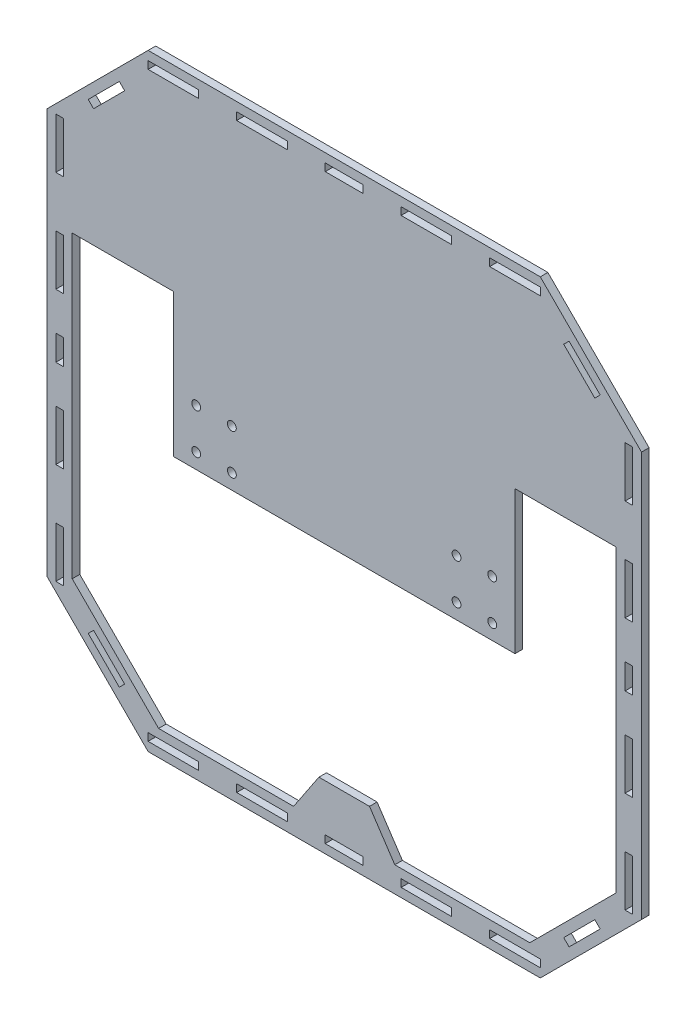
from build123d import *

# Parameters (mm, degrees)
SKICA2_R                = 1.75
SKICA2_W                = 3
SKICA2_H                = 20
SKICA2_H_2              = 10
SKICA2_W_2              = 20
SKICA2_H_3              = 3
SKICA2_W_3              = 15
P_IDAT_VYSUNUT_M1_DEPTH = 3


with BuildPart() as part:
    # Skica2 → Přidat vysunutím1 (new body)
    with BuildSketch(Plane.XY):
        Polygon((-117.5, 80), (-77.5, 120), (77.5, 120), (117.5, 80), (117.5, -80), (77.5, -120), (-77.5, -120), (-117.5, -80), align=None)
        with Locations((58.5, 8)):
            Circle(SKICA2_R, mode=Mode.SUBTRACT)
        with Locations((44.4, 8)):
            Circle(SKICA2_R, mode=Mode.SUBTRACT)
        with Locations(Location((44.4, -8, 0), (0, 0, 180))):
            Circle(SKICA2_R, mode=Mode.SUBTRACT)
        with Locations(Location((58.5, -8, 0), (0, 0, 180))):
            Circle(SKICA2_R, mode=Mode.SUBTRACT)
        with Locations((-44.4, -8)):
            Circle(SKICA2_R, mode=Mode.SUBTRACT)
        with Locations((-58.5, -8)):
            Circle(SKICA2_R, mode=Mode.SUBTRACT)
        with Locations(Location((-58.5, 8, 0), (0, 0, 180))):
            Circle(SKICA2_R, mode=Mode.SUBTRACT)
        with Locations(Location((-44.4, 8, 0), (0, 0, 180))):
            Circle(SKICA2_R, mode=Mode.SUBTRACT)
        Polygon((-107.5, -42.5), (-107.5, 42.5), (-67.5, 42.5), (-67.5, -14), (67.5, -14), (67.5, 42.5), (107.5, 42.5), (107.5, -42.5), (107.5, -75.857864376), (73.357864376, -110), (20, -110), (10, -95), (-10, -95), (-20, -110), (-73.357864376, -110), (-107.5, -75.857864376), align=None, mode=Mode.SUBTRACT)
        with Locations((-112.5, 70)):
            Rectangle(SKICA2_W, SKICA2_H, mode=Mode.SUBTRACT)
        with Locations((-112.5, 30)):
            Rectangle(SKICA2_W, SKICA2_H, mode=Mode.SUBTRACT)
        with Locations((-112.5, 0)):
            Rectangle(SKICA2_W, SKICA2_H_2, mode=Mode.SUBTRACT)
        with Locations((-112.5, -30)):
            Rectangle(SKICA2_W, SKICA2_H, mode=Mode.SUBTRACT)
        with Locations((-112.5, -70)):
            Rectangle(SKICA2_W, SKICA2_H, mode=Mode.SUBTRACT)
        with Locations((112.5, -70)):
            Rectangle(SKICA2_W, SKICA2_H, mode=Mode.SUBTRACT)
        with Locations((112.5, -30)):
            Rectangle(SKICA2_W, SKICA2_H, mode=Mode.SUBTRACT)
        with Locations((112.5, 0)):
            Rectangle(SKICA2_W, SKICA2_H_2, mode=Mode.SUBTRACT)
        with Locations((112.5, 30)):
            Rectangle(SKICA2_W, SKICA2_H, mode=Mode.SUBTRACT)
        with Locations((112.5, 70)):
            Rectangle(SKICA2_W, SKICA2_H, mode=Mode.SUBTRACT)
        with Locations((-67.5, 115)):
            Rectangle(SKICA2_W_2, SKICA2_H_3, mode=Mode.SUBTRACT)
        with Locations((-32.5, 115)):
            Rectangle(SKICA2_W_2, SKICA2_H_3, mode=Mode.SUBTRACT)
        with Locations((0, 115)):
            Rectangle(SKICA2_W_3, SKICA2_H_3, mode=Mode.SUBTRACT)
        with Locations((32.5, 115)):
            Rectangle(SKICA2_W_2, SKICA2_H_3, mode=Mode.SUBTRACT)
        with Locations((67.5, 115)):
            Rectangle(SKICA2_W_2, SKICA2_H_3, mode=Mode.SUBTRACT)
        with Locations((67.5, -115)):
            Rectangle(SKICA2_W_2, SKICA2_H_3, mode=Mode.SUBTRACT)
        with Locations((32.5, -115)):
            Rectangle(SKICA2_W_2, SKICA2_H_3, mode=Mode.SUBTRACT)
        with Locations((0, -115)):
            Rectangle(SKICA2_W_3, SKICA2_H_3, mode=Mode.SUBTRACT)
        with Locations((-32.5, -115)):
            Rectangle(SKICA2_W_2, SKICA2_H_3, mode=Mode.SUBTRACT)
        with Locations((-67.5, -115)):
            Rectangle(SKICA2_W_2, SKICA2_H_3, mode=Mode.SUBTRACT)
        Polygon((101.168524548, -91.381727984), (88.881727984, -103.668524548), (86.76040764, -101.547204204), (99.047204204, -89.26040764), align=None, mode=Mode.SUBTRACT)
        Polygon((-86.76040764, -101.547204204), (-99.047204204, -89.26040764), (-101.168524548, -91.381727984), (-88.881727984, -103.668524548), align=None, mode=Mode.SUBTRACT)
        Polygon((86.76040764, 101.547204204), (99.047204204, 89.26040764), (101.168524548, 91.381727984), (88.881727984, 103.668524548), align=None, mode=Mode.SUBTRACT)
        Polygon((-88.881727984, 103.668524548), (-86.76040764, 101.547204204), (-99.047204204, 89.26040764), (-101.168524548, 91.381727984), align=None, mode=Mode.SUBTRACT)
    extrude(amount=P_IDAT_VYSUNUT_M1_DEPTH)


solid = part.part
